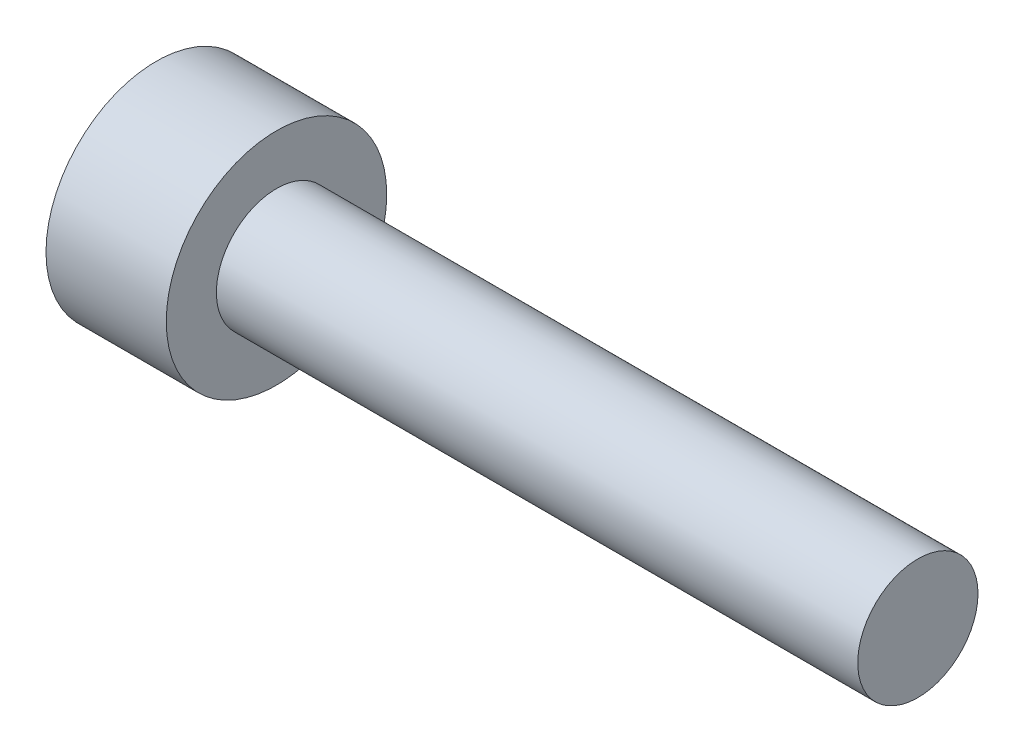
from build123d import *

# Parameters (mm, degrees)
SKIZZE1_R                       = 2.75
AUFSATZ_LINEAR_AUSTRAGEN1_DEPTH = 3
AUFSATZ_LINEAR_START            = 3
SKIZZE2_R                       = 1.5
AUFSATZ_LINEAR_AUSTRAGEN2_DEPTH = 16


with BuildPart() as part:
    # Skizze1 → Aufsatz-Linear austragen1 (new body)
    with BuildSketch(Plane.YZ):
        with Locations(Location((0, 0, 0), (0, 0, 270))):
            Circle(SKIZZE1_R)
    extrude(amount=AUFSATZ_LINEAR_AUSTRAGEN1_DEPTH)

    # Skizze2 → Aufsatz-Linear austragen2 (add)
    with BuildSketch(Plane.YZ.offset(AUFSATZ_LINEAR_START)):
        with Locations(Location((0, 0, 0), (0, 0, 270))):
            Circle(SKIZZE2_R)
    extrude(amount=AUFSATZ_LINEAR_AUSTRAGEN2_DEPTH)


solid = part.part
